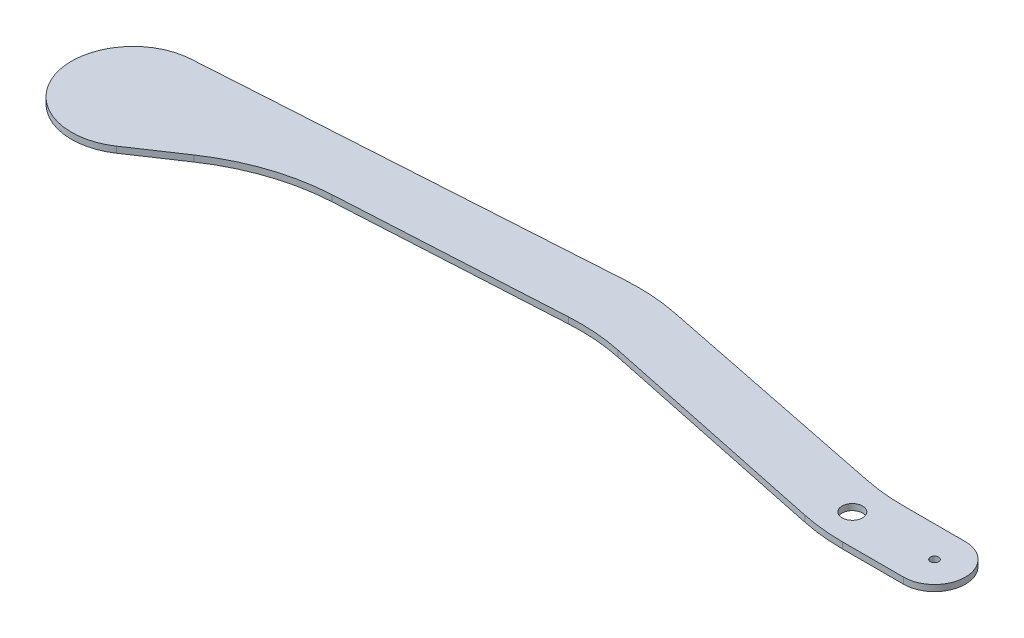
from build123d import *

# Parameters (mm, degrees)
SKETCH1_R           = 5
SKETCH1_R_2         = 2
BOSS_EXTRUDE1_DEPTH = 3
FILLET1_R           = 100


with BuildPart() as part:
    # Sketch1 → Boss-Extrude1 (new body)
    with BuildSketch(Plane(origin=(0, 0, 0), x_dir=(1, 0, 0), z_dir=(0, 1, 0))):
        with BuildLine():
            Line((0, 15), (-139.784941349, 43.225909045))
            Line((-139.784941349, 43.225909045), (-351.875415017, 29.941322925))
            ThreePointArc((-351.875415017, 29.941322925), (-378.412739548, -9.628926804), (-333.285739517, -24.912516864))
            Line((-333.285739517, -24.912516864), (-287.823465989, 5.588948968))
            Line((-287.823465989, 5.588948968), (-138.053278996, 13.889014505))
            Line((-138.053278996, 13.889014505), (-5.919683, -13.782501703))
            Line((-5.919683, -13.782501703), (0, -15))
            Line((0, -15), (40, -15))
            ThreePointArc((40, -15), (55, 0), (40, 15))
            Line((40, 15), (0, 15))
        make_face()
        with Locations(Location((0, 0, 0), (0, 0, 270))):
            Circle(SKETCH1_R, mode=Mode.SUBTRACT)
        with Locations(Location((40, 0, 0), (0, 0, 270))):
            Circle(SKETCH1_R_2, mode=Mode.SUBTRACT)
    extrude(amount=BOSS_EXTRUDE1_DEPTH)

    # Fillet1
    fillet1_edges = [part.edges().sort_by_distance(p)[0] for p in [
        (0, 1.5, -15),
        (-139.784941349, 1.5, -43.225909045),
        (-138.053278996, 1.5, -13.889014505),
        (-287.823465989, 1.5, -5.588948968),
        (0, 1.5, 15),
    ]]
    fillet(fillet1_edges, radius=FILLET1_R)


solid = part.part
